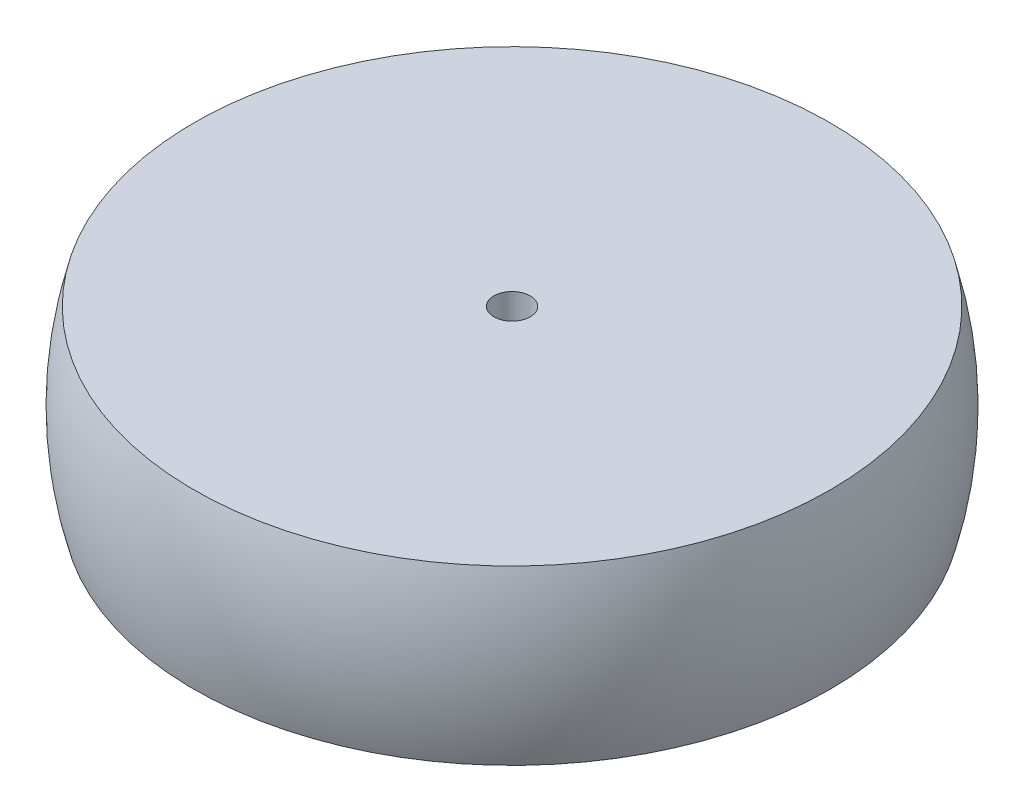
from build123d import *

# Parameters (mm, degrees)
SKETCH2_R          = 2
CUT_EXTRUDE1_DEPTH = 58.056989055


with BuildPart() as part:
    # Sketch1 → Revolve2 (revolve)
    with BuildSketch(Plane.XY):
        with BuildLine():
            Line((0, 0), (0, 25))
            Line((0, 25), (35, 25))
            ThreePointArc((35, 25), (36.266375612, 15.5), (35, 6))
            Line((35, 6), (6, 6))
            Line((6, 6), (6, 0))
            Line((6, 0), (0, 0))
        make_face()
    revolve(axis=Axis((0, 0, 0), (0, 1, 0)))

    # Sketch2 → Cut-Extrude1 (cut, through all)
    with BuildSketch(Plane.XZ):
        with Locations(Location((0, 0, 0), (0, 0, 270))):
            Circle(SKETCH2_R)
    extrude(amount=-CUT_EXTRUDE1_DEPTH, mode=Mode.SUBTRACT)


solid = part.part
